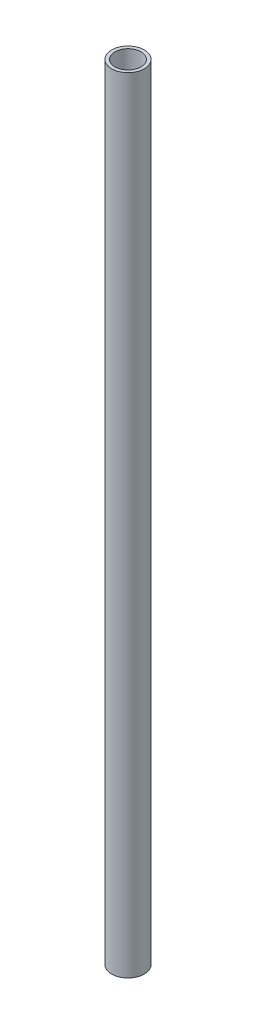
from build123d import *

# Parameters (mm, degrees)
SKETCH_1_R      = 10
SKETCH_1_R_2    = 8
EXTRUDE_1_DEPTH = 480


with BuildPart() as part:
    # 草图1 → 凸台-拉伸1 (new body)
    with BuildSketch(Plane(origin=(0, 0, 0), x_dir=(1, 0, 0), z_dir=(0, 1, 0))):
        with Locations(Location((0, 0, 0), (0, 0, 270))):
            Circle(SKETCH_1_R)
        with Locations(Location((0, 0, 0), (0, 0, 270))):
            Circle(SKETCH_1_R_2, mode=Mode.SUBTRACT)
    extrude(amount=EXTRUDE_1_DEPTH)


solid = part.part
